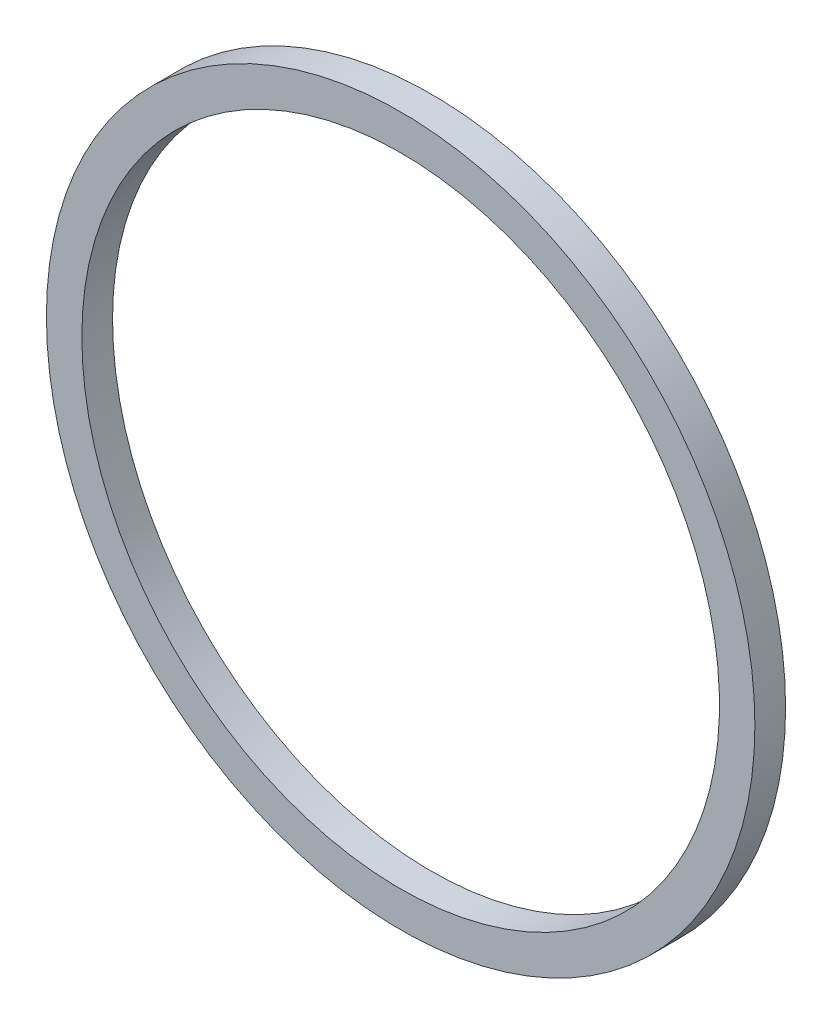
from build123d import *

# Parameters (mm, degrees)
SKETCH_1_R      = 150
SKETCH_1_R_2    = 135
EXTRUDE_1_DEPTH = 13


with BuildPart() as part:
    # 草图1 → 凸台-拉伸1 (new body)
    with BuildSketch(Plane.XY):
        with Locations(Location((0, 0, 0), (0, 0, 180))):
            Circle(SKETCH_1_R)
        with Locations(Location((0, 0, 0), (0, 0, 180))):
            Circle(SKETCH_1_R_2, mode=Mode.SUBTRACT)
    extrude(amount=EXTRUDE_1_DEPTH)


solid = part.part
